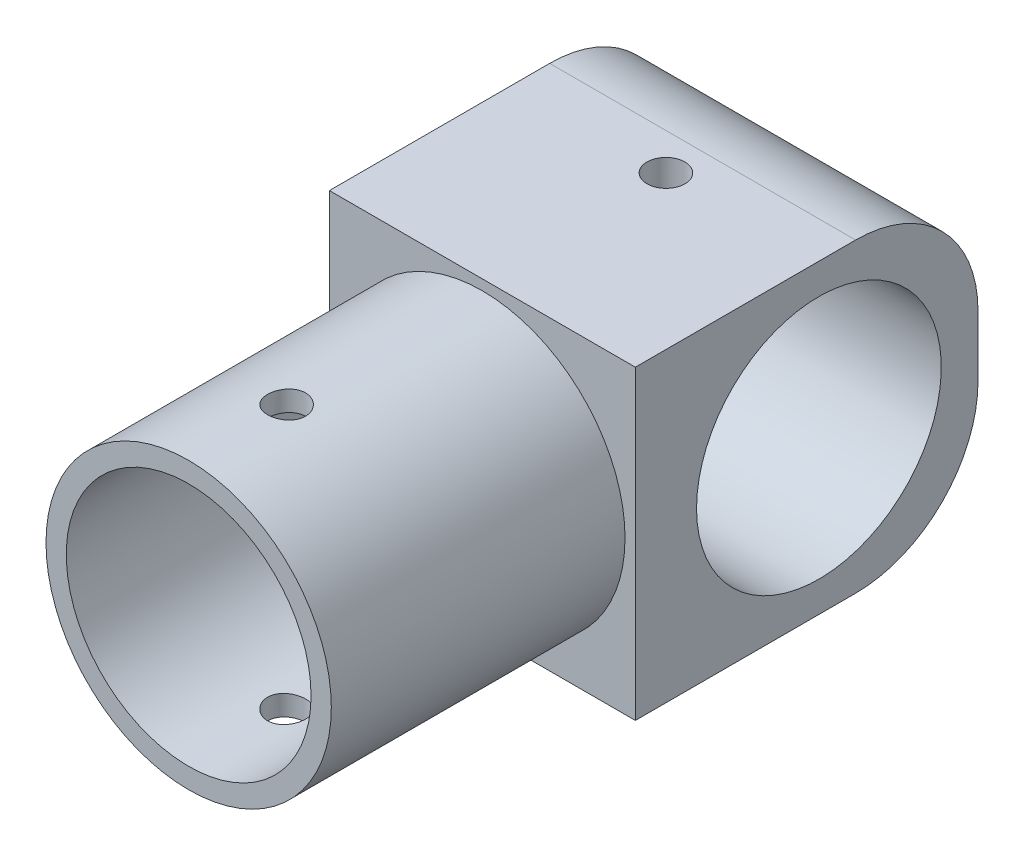
from build123d import *

# Parameters (mm, degrees)
SKETCH_1_W                  = 25
SKETCH_1_H                  = 28
EXTRUDE_1_DEPTH             = 25
SKETCH_2_W                  = 11.657397777
SKETCH_2_H                  = 24
HOLE_WIZARD_20_0_20_1_D     = 20
HOLE_WIZARD_20_0_20_2_D     = 20
HOLE_WIZARD_20_0_20_2_DEPTH = 23
FILLET_1_R                  = 10
CUT_EXTRUDE_1_DEPTH         = 35.766927543
CUT_EXTRUDE_1_DEPTH_BACK    = 35.766927543
SKETCH_7_R                  = 1.55
SKETCH_9_R                  = 1.55
CUT_EXTRUDE_2_DEPTH         = 41.957163608


with BuildPart() as part:
    # 草图1 → 凸台-拉伸1 (new body)
    with BuildSketch(Plane.XZ.offset(5.250668647)):
        with Locations((3.885641605, -14)):
            Rectangle(SKETCH_1_W, SKETCH_1_H)
    extrude(amount=-EXTRUDE_1_DEPTH)

    # 草图2 → 旋转1 (revolve)
    with BuildSketch(Plane.XZ.offset(-7.249331353), mode=Mode.PRIVATE) as revolve_1_sk:
        with Locations((9.714340494, 12)):
            Rectangle(SKETCH_2_W, SKETCH_2_H)
    revolve(revolve_1_sk.sketch.rotate(Axis((3.885641605, 7.249331353, 24), (0, 0, -1)), 180), axis=Axis((3.885641605, 7.249331353, 24), (0, 0, -1)))

    # Ø20.0 (20) 直径孔1 (through all)
    with Locations(Plane.ZY.offset(8.614358395)):
        with Locations((-15, 7.249331353)):
            Hole(HOLE_WIZARD_20_0_20_1_D / 2)

    # Ø20.0 (20) 直径孔2
    with Locations(Plane.XY.offset(24)):
        with Locations((3.885641605, 7.249331353)):
            Hole(HOLE_WIZARD_20_0_20_2_D / 2, depth=HOLE_WIZARD_20_0_20_2_DEPTH)

    # 圆角1
    fillet_1_edges = [part.edges().sort_by_distance(p)[0] for p in [
        (3.885641605, 19.749331353, -28),
        (3.885641605, -5.250668647, -28),
    ]]
    fillet(fillet_1_edges, radius=FILLET_1_R)

    # 草图7 → 切除-拉伸1 (cut, two sides: drawn at the far end of the back side and taken through both)
    with BuildSketch(Plane.XZ.offset(-7.249331353).offset(-CUT_EXTRUDE_1_DEPTH_BACK)):
        with Locations(Location((3.885641605, 16, 0), (0, 0, 270))):
            Circle(SKETCH_7_R)
    extrude(amount=CUT_EXTRUDE_1_DEPTH + CUT_EXTRUDE_1_DEPTH_BACK, mode=Mode.SUBTRACT)

    # 草图9 → 切除-拉伸2 (cut, through all)
    with BuildSketch(Plane(origin=(0, 19.749331353, 0), x_dir=(1, 0, 0), z_dir=(0, 1, 0))):
        with Locations(Location((3.885641605, 15, 0), (0, 0, 270))):
            Circle(SKETCH_9_R)
    extrude(amount=-CUT_EXTRUDE_2_DEPTH, mode=Mode.SUBTRACT)


solid = part.part
